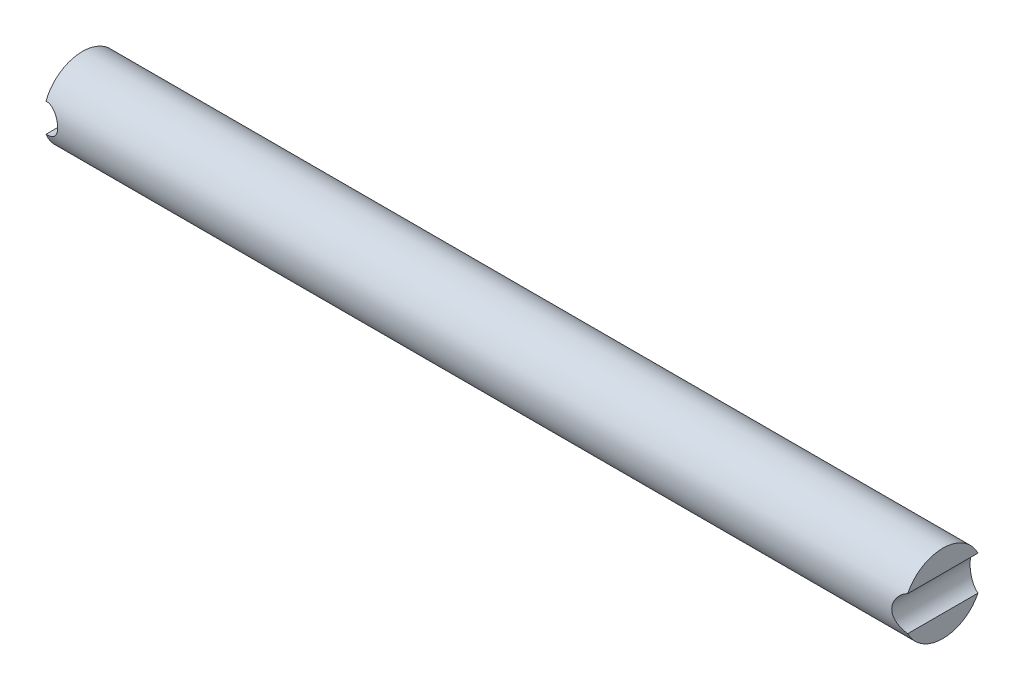
from build123d import *

# Parameters (mm, degrees)
SKETCH1_R                         = 23
LENGTH_DEPTH                      = 505
FEMUR_HOLE_REACH                  = 508.046
FEMUR_HOLE_END_RADIUS             = 23
SKETCH2_R                         = 8.430886207
SKETCH2_R_2                       = 10.877092796
FEMUR_HOLE_DIRECTION_2_REACH      = 508.046
FEMUR_HOLE_DIRECTION_2_END_RADIUS = 23


with BuildPart() as part:
    # Sketch1 → Length (new body)
    with BuildSketch(Plane(origin=(0, 0, 0), x_dir=(0, 0, -1), z_dir=(1, 0, 0))):
        Circle(SKETCH1_R)
    extrude(amount=LENGTH_DEPTH)

    # Femur hole: up to this cylinder (the profile starts inside it)
    femur_hole_end = Plane(origin=(254.436174, 0, 0), z_dir=(-1, 0, 0)) * Cylinder(FEMUR_HOLE_END_RADIUS, 1571.964348, mode=Mode.PRIVATE)
    # Sketch2 → Femur hole (cut, up to the surface)
    with BuildSketch(Plane.XY, mode=Mode.PRIVATE) as femur_hole_sk1:
        Circle(SKETCH2_R)
    femur_hole_tool1 = extrude(femur_hole_sk1.sketch, amount=-FEMUR_HOLE_REACH, mode=Mode.PRIVATE) & femur_hole_end
    add(femur_hole_tool1.solids().sort_by_distance((0, 0, 0))[0], mode=Mode.SUBTRACT)
    # Sketch2 → Femur hole (cut, up to the surface)
    with BuildSketch(Plane.XY, mode=Mode.PRIVATE) as femur_hole_sk2:
        with Locations((508.872347898, 0)):
            Circle(SKETCH2_R_2)
    femur_hole_tool2 = extrude(femur_hole_sk2.sketch, amount=-FEMUR_HOLE_REACH, mode=Mode.PRIVATE) & femur_hole_end
    add(femur_hole_tool2.solids().sort_by_distance((508.872348, 0, 0))[0], mode=Mode.SUBTRACT)

    # Femur hole direction 2: up to this cylinder (the profile starts inside it)
    femur_hole_direction_2_end = Plane(origin=(254.436174, 0, 0), z_dir=(-1, 0, 0)) * Cylinder(FEMUR_HOLE_DIRECTION_2_END_RADIUS, 1571.964348, mode=Mode.PRIVATE)
    # Sketch2 → Femur hole direction 2 (cut, up to the surface)
    with BuildSketch(Plane.XY, mode=Mode.PRIVATE) as femur_hole_direction_2_sk1:
        Circle(SKETCH2_R)
    femur_hole_direction_2_tool1 = extrude(femur_hole_direction_2_sk1.sketch, amount=FEMUR_HOLE_DIRECTION_2_REACH, mode=Mode.PRIVATE) & femur_hole_direction_2_end
    add(femur_hole_direction_2_tool1.solids().sort_by_distance((0, 0, 0))[0], mode=Mode.SUBTRACT)
    # Sketch2 → Femur hole direction 2 (cut, up to the surface)
    with BuildSketch(Plane.XY, mode=Mode.PRIVATE) as femur_hole_direction_2_sk2:
        with Locations((508.872347898, 0)):
            Circle(SKETCH2_R_2)
    femur_hole_direction_2_tool2 = extrude(femur_hole_direction_2_sk2.sketch, amount=FEMUR_HOLE_DIRECTION_2_REACH, mode=Mode.PRIVATE) & femur_hole_direction_2_end
    add(femur_hole_direction_2_tool2.solids().sort_by_distance((508.872348, 0, 0))[0], mode=Mode.SUBTRACT)


solid = part.part
